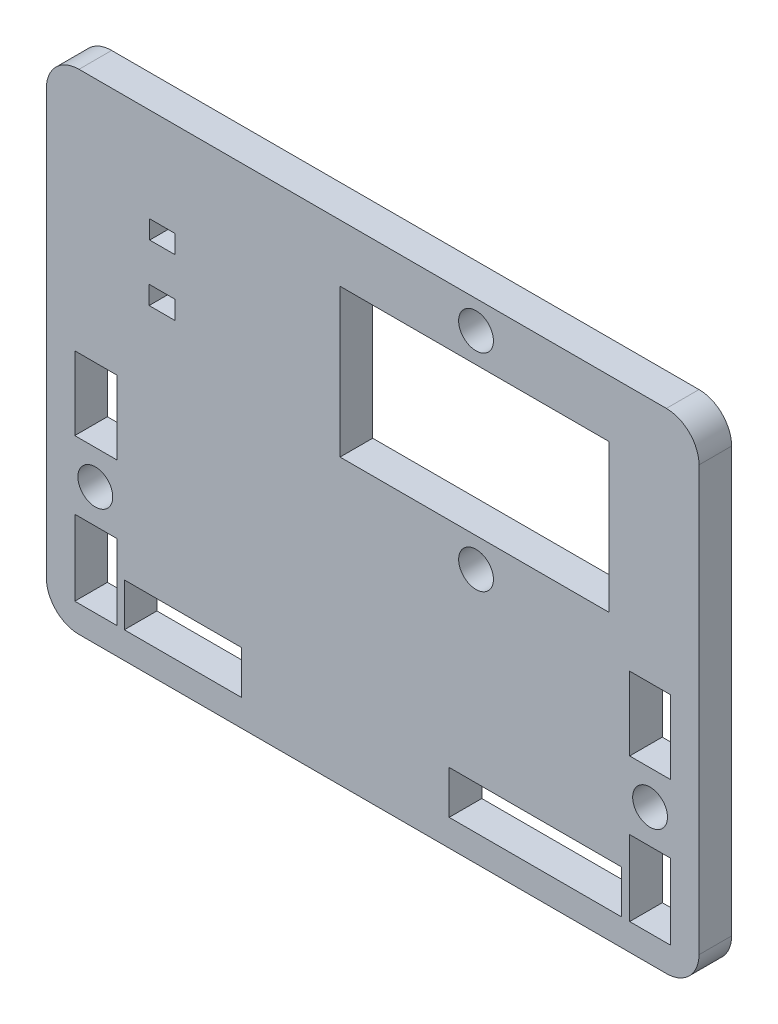
from build123d import *

# Parameters (mm, degrees)
SKETCH_1_R          = 1.35
SKETCH_1_R_2        = 1.6
SKETCH_1_W          = 10.785023523
SKETCH_1_H          = 3.975869969
SKETCH_1_W_2        = 3.881137471
SKETCH_1_H_2        = 6.926362959
SKETCH_1_H_3        = 6.753909589
SKETCH_1_W_3        = 2.381
SKETCH_1_H_4        = 1.694
SKETCH_1_W_4        = 2.327
SKETCH_1_H_5        = 1.693
SKETCH_1_W_5        = 24.737091535
SKETCH_1_H_6        = 13.600314953
SKETCH_1_W_6        = 15.83465493
SKETCH_1_W_7        = 3.735479659
EXTRUDE_1_DEPTH     = 3
SKETCH_2_R          = 1.6
CUT_EXTRUDE_1_DEPTH = 55.763647529


with BuildPart() as part:
    # 草图1 → 凸台-拉伸1 (new body)
    with BuildSketch(Plane(origin=(0, 0, 0), x_dir=(-1, 0, 0), z_dir=(0, 0, -1))):
        with BuildLine():
            Line((28.933183464, 3), (28.933183464, 41.999))
            ThreePointArc((28.933183464, 41.999), (28.054503808, 44.120320344), (25.933183464, 44.999))
            Line((25.933183464, 44.999), (-28.066816536, 44.999))
            ThreePointArc((-28.066816536, 44.999), (-30.18813688, 44.120320344), (-31.066816536, 41.999))
            Line((-31.066816536, 41.999), (-31.066816536, 3))
            ThreePointArc((-31.066816536, 3), (-30.18813688, 0.878679656), (-28.066816536, 0))
            Line((-28.066816536, 0), (25.933183464, 0))
            ThreePointArc((25.933183464, 0), (28.054503808, 0.878679656), (28.933183464, 3))
        make_face()
        with Locations(Location((-26.567767322, 12.499, 0), (0, 0, 180))):
            Circle(SKETCH_1_R, mode=Mode.SUBTRACT)
        with Locations(Location((-10.567816536, 23.43, 0), (0, 0, 180))):
            Circle(SKETCH_1_R_2, mode=Mode.SUBTRACT)
        with Locations(Location((24.432183464, 12.499, 0), (0, 0, 180))):
            Circle(SKETCH_1_R, mode=Mode.SUBTRACT)
        with Locations(Location((-10.567816536, 42.43, 0), (0, 0, 180))):
            Circle(SKETCH_1_R_2, mode=Mode.SUBTRACT)
        with Locations((16.376273559, 4.440236649)):
            Rectangle(SKETCH_1_W, SKETCH_1_H, mode=Mode.SUBTRACT)
        with Locations((24.382587874, 5.915483144)):
            Rectangle(SKETCH_1_W_2, SKETCH_1_H_2, mode=Mode.SUBTRACT)
        with Locations((24.382587874, 19.014796064)):
            Rectangle(SKETCH_1_W_2, SKETCH_1_H_3, mode=Mode.SUBTRACT)
        with Locations((18.298683464, 30.257)):
            Rectangle(SKETCH_1_W_3, SKETCH_1_H_4, mode=Mode.SUBTRACT)
        with Locations((18.271683464, 35.4965)):
            Rectangle(SKETCH_1_W_4, SKETCH_1_H_5, mode=Mode.SUBTRACT)
        with Locations((-10.43601502, 32.923896791)):
            Rectangle(SKETCH_1_W_5, SKETCH_1_H_6, mode=Mode.SUBTRACT)
        with Locations((-16.015517123, 4.440236649)):
            Rectangle(SKETCH_1_W_6, SKETCH_1_H, mode=Mode.SUBTRACT)
        with Locations((-26.559738671, 5.915483144)):
            Rectangle(SKETCH_1_W_7, SKETCH_1_H_2, mode=Mode.SUBTRACT)
        with Locations((-26.559738671, 19.014796064)):
            Rectangle(SKETCH_1_W_7, SKETCH_1_H_3, mode=Mode.SUBTRACT)
    extrude(amount=-EXTRUDE_1_DEPTH)

    # 草图2 → 切除-拉伸1 (cut, through all)
    with BuildSketch(Plane.XY.offset(3)):
        with Locations((-24.432183464, 12.499)):
            Circle(SKETCH_2_R)
        with Locations((26.567767322, 12.499)):
            Circle(SKETCH_2_R)
    extrude(amount=-CUT_EXTRUDE_1_DEPTH, mode=Mode.SUBTRACT)


solid = part.part
